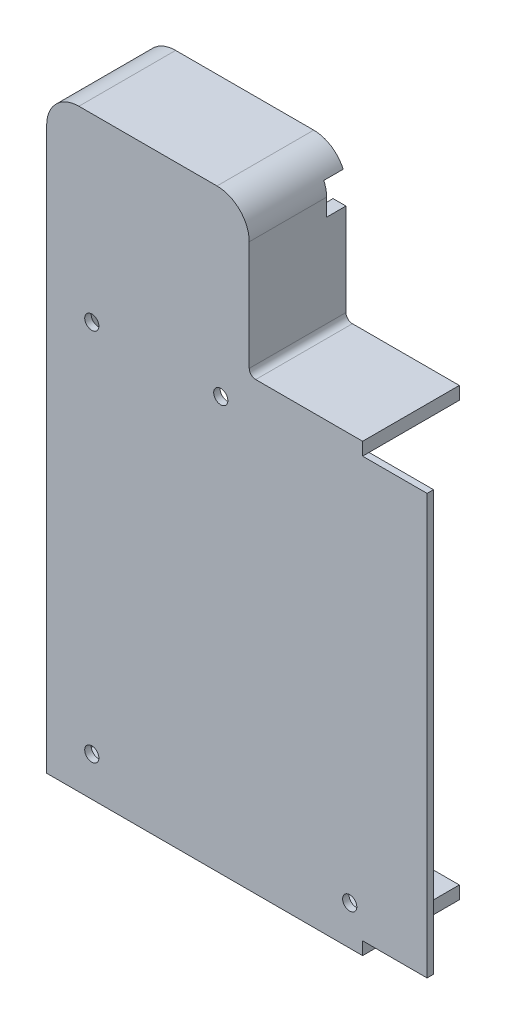
from build123d import *

# Parameters (mm, degrees)
BOSS_EXTRUDE1_DEPTH = 15
BOSS_EXTRUDE2_DEPTH = 15
CUT_EXTRUDE1_DEPTH  = 14
SKETCH8_W           = 6.699223296
SKETCH8_H           = 4.721357371
SKETCH8_W_2         = 8.228893272
CUT_EXTRUDE7_DEPTH  = 3
SKETCH10_R          = 1.1
CUT_EXTRUDE9_DEPTH  = 15


with BuildPart() as part:
    # Sketch3 → Boss-Extrude1 (new body)
    with BuildSketch(Plane.XY.offset(1303.472903018)):
        with BuildLine():
            Line((787.650097371, 1035.49652121), (787.650097371, 1120.589424436))
            ThreePointArc((787.650097371, 1120.589424436), (788.529097371, 1122.710424436), (790.650097371, 1123.589424436))
            Line((790.650097371, 1123.589424436), (812.066097371, 1123.589424436))
            ThreePointArc((812.066097371, 1123.589424436), (814.187097371, 1122.710424436), (815.066097371, 1120.589424436))
            Line((815.066097371, 1120.589424436), (815.066097371, 1103.589424436))
            ThreePointArc((815.066097371, 1103.589424436), (815.945097371, 1101.468424436), (818.066097371, 1100.589424436))
            Line((818.066097371, 1100.589424436), (834.650097371, 1100.589424436))
            Line((834.650097371, 1100.589424436), (834.650461973, 1102.58942437))
            Line((834.650461973, 1102.58942437), (818.066461973, 1102.58942437))
            ThreePointArc((818.066461973, 1102.58942437), (817.35931084, 1102.882637905), (817.066097305, 1103.589789038))
            Line((817.066097305, 1103.589789038), (817.066097305, 1120.589789038))
            ThreePointArc((817.066097305, 1120.589789038), (815.601310896, 1124.124637961), (812.066461973, 1125.58942437))
            Line((812.066461973, 1125.58942437), (790.64973277, 1125.58942437))
            ThreePointArc((790.64973277, 1125.58942437), (787.114883847, 1124.124637961), (785.650097438, 1120.589789038))
            Line((785.650097438, 1120.589789038), (785.650097371, 1033.49652121))
            Line((785.650097371, 1033.49652121), (834.649003168, 1033.49652121))
            Line((834.649003168, 1033.49652121), (834.649003168, 1035.49652121))
            Line((834.649003168, 1035.49652121), (787.650097371, 1035.49652121))
        make_face()
    extrude(amount=BOSS_EXTRUDE1_DEPTH)

    # Sketch6 → Boss-Extrude2 (add)
    with BuildSketch(Plane.XY.offset(1303.472903018)):
        with BuildLine():
            Line((787.650097371, 1035.49652121), (834.649003168, 1035.49652121))
            Line((834.649003168, 1035.49652121), (844.649003168, 1035.49652121))
            Line((844.649003168, 1035.49652121), (844.650097371, 1100.589424436))
            Line((844.650097371, 1100.589424436), (834.650097371, 1100.589424436))
            Line((834.650097371, 1100.589424436), (818.066097371, 1100.589424436))
            ThreePointArc((818.066097371, 1100.589424436), (815.945097371, 1101.468424436), (815.066097371, 1103.589424436))
            Line((815.066097371, 1103.589424436), (815.066097371, 1120.589424436))
            ThreePointArc((815.066097371, 1120.589424436), (814.187097371, 1122.710424436), (812.066097371, 1123.589424436))
            Line((812.066097371, 1123.589424436), (790.650097371, 1123.589424436))
            ThreePointArc((790.650097371, 1123.589424436), (788.529097371, 1122.710424436), (787.650097371, 1120.589424436))
            Line((787.650097371, 1120.589424436), (787.650097371, 1035.49652121))
        make_face()
    extrude(amount=BOSS_EXTRUDE2_DEPTH)

    # Sketch6<2> → Cut-Extrude1 (cut)
    with BuildSketch(Plane.XY.offset(1303.472903018)):
        with BuildLine():
            Line((787.650097371, 1035.49652121), (834.649003168, 1035.49652121))
            Line((834.649003168, 1035.49652121), (844.649003168, 1035.49652121))
            Line((844.649003168, 1035.49652121), (844.650097371, 1100.589424436))
            Line((844.650097371, 1100.589424436), (834.650097371, 1100.589424436))
            Line((834.650097371, 1100.589424436), (818.066097371, 1100.589424436))
            ThreePointArc((818.066097371, 1100.589424436), (815.945097371, 1101.468424436), (815.066097371, 1103.589424436))
            Line((815.066097371, 1103.589424436), (815.066097371, 1120.589424436))
            ThreePointArc((815.066097371, 1120.589424436), (814.187097371, 1122.710424436), (812.066097371, 1123.589424436))
            Line((812.066097371, 1123.589424436), (790.650097371, 1123.589424436))
            ThreePointArc((790.650097371, 1123.589424436), (788.529097371, 1122.710424436), (787.650097371, 1120.589424436))
            Line((787.650097371, 1120.589424436), (787.650097371, 1035.49652121))
        make_face()
    extrude(amount=CUT_EXTRUDE1_DEPTH, mode=Mode.SUBTRACT)

    # Sketch8 → Cut-Extrude7 (cut)
    with BuildSketch(Plane.XY.offset(1303.472903018)):
        with Locations((788.177093813, 1120.255926572)):
            Rectangle(SKETCH8_W, SKETCH8_H)
        with Locations((813.958809837, 1120.255926572)):
            Rectangle(SKETCH8_W_2, SKETCH8_H)
    extrude(amount=CUT_EXTRUDE7_DEPTH, mode=Mode.SUBTRACT)

    # Sketch10 → Cut-Extrude9 (cut)
    with BuildSketch(Plane.XY.offset(1303.472903018)):
        with Locations((832.650097371, 1039.589424436)):
            Circle(SKETCH10_R)
        with Locations((792.650097371, 1039.589424436)):
            Circle(SKETCH10_R)
        with Locations((792.650097371, 1097.589424436)):
            Circle(SKETCH10_R)
        with Locations((812.650097371, 1097.589424436)):
            Circle(SKETCH10_R)
    extrude(amount=CUT_EXTRUDE9_DEPTH, mode=Mode.SUBTRACT)


solid = part.part
